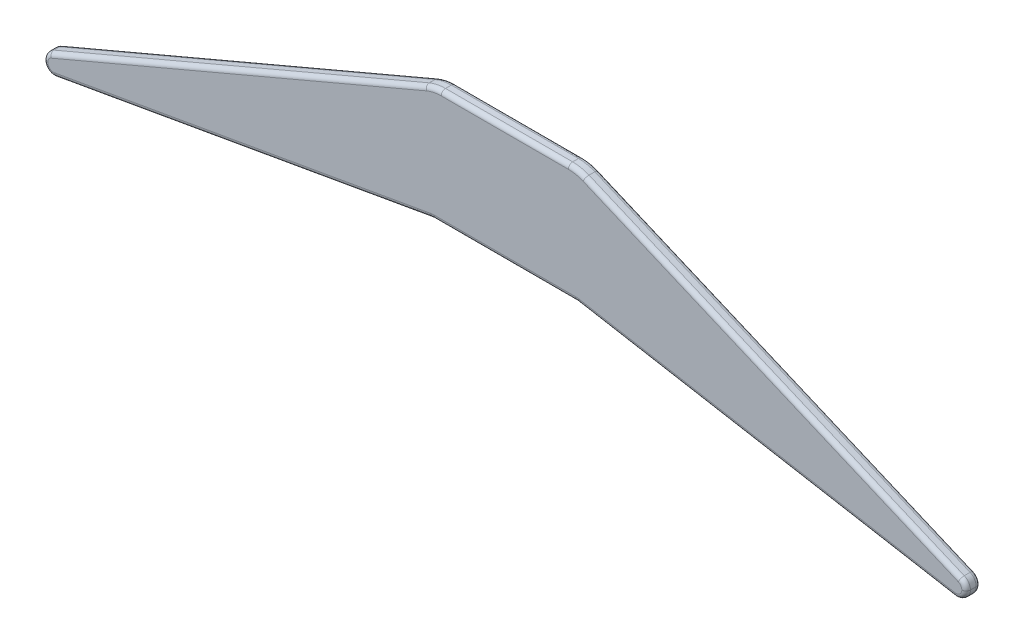
from build123d import *

# Parameters (mm, degrees)
BOSS_EXTRU_1_DEPTH = 100
CONG_1_R           = 70
CONG_2_R           = 110
CONG_3_R           = 290
CONG_4_R           = 30
CONG_5_R           = 30


with BuildPart() as part:
    # Esquisse1 → Boss.-Extru.1 (new body)
    with BuildSketch(Plane.XY):
        Polygon((-500, 400), (-3200.00340179, -746.08344774), (-3200.00340179, -876.08344774), (-500, -400), (500, -400), (3200.00340179, -876.08344774), (3200.00340179, -746.08344774), (500, 400), align=None)
    extrude(amount=BOSS_EXTRU_1_DEPTH)

    # Congé1
    cong_1_edges = [part.edges().sort_by_distance(p)[0] for p in [
        (3200.00340179, -746.08344774, 50),
        (3200.00340179, -876.08344774, 50),
        (-3200.00340179, -876.08344774, 50),
        (-3200.00340179, -746.08344774, 50),
    ]]
    fillet(cong_1_edges, radius=CONG_1_R)

    # Congé2
    cong_2_edges = [part.edges().sort_by_distance(p)[0] for p in [
        (500, -400, 50),
        (-500, -400, 50),
    ]]
    fillet(cong_2_edges, radius=CONG_2_R)

    # Congé3
    cong_3_edges = [part.edges().sort_by_distance(p)[0] for p in [
        (-500, 400, 50),
        (500, 400, 50),
    ]]
    fillet(cong_3_edges, radius=CONG_3_R)

    # Congé4
    cong_4_edges = [part.edges().sort_by_distance(p)[0] for p in [
        (3200.00340179, -792.538066641, 100),
        (1855.832720607, -175.516844891, 100),
        (-3200.00340179, -792.538066641, 100),
        (-1813.662787955, -631.634193069, 100),
        (-3188.375409335, -753.779848052, 100),
        (-3174.998534468, -846.283807277, 100),
        (3188.375409335, -753.779848052, 100),
        (3174.998534468, -846.283807277, 100),
        (0, -400, 100),
        (1813.662787955, -631.634193069, 100),
        (-499.963378714, -400.41858321, 100),
        (499.963378714, -400.41858321, 100),
        (-1855.832720607, -175.516844891, 100),
        (0, 400, 100),
        (498.815534148, 394.17816434, 100),
        (-498.815534148, 394.17816434, 100),
    ]]
    fillet(cong_4_edges, radius=CONG_4_R)

    # Congé5
    cong_5_edges = [part.edges().sort_by_distance(p)[0] for p in [
        (3200.00340179, -792.538066641, 0),
        (1855.832720607, -175.516844891, 0),
        (-1813.662787955, -631.634193069, 0),
        (-3200.00340179, -792.538066641, 0),
        (-3188.375409335, -753.779848052, 0),
        (-3174.998534468, -846.283807277, 0),
        (3188.375409335, -753.779848052, 0),
        (3174.998534468, -846.283807277, 0),
        (0, -400, 0),
        (1813.662787955, -631.634193069, 0),
        (-499.963378714, -400.41858321, 0),
        (499.963378714, -400.41858321, 0),
        (-1855.832720607, -175.516844891, 0),
        (0, 400, 0),
        (498.815534148, 394.17816434, 0),
        (-498.815534148, 394.17816434, 0),
    ]]
    fillet(cong_5_edges, radius=CONG_5_R)


solid = part.part
